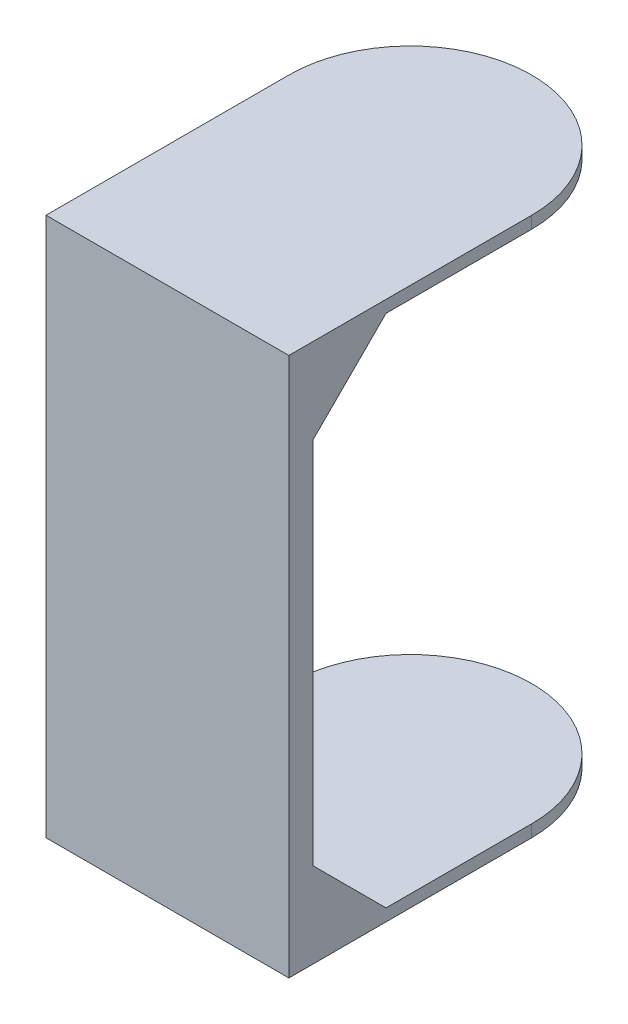
from build123d import *

# Parameters (mm, degrees)
PLATE_SKETCH_W                  = 100
PLATE_SKETCH_H                  = 212
PLATE_EXTRUDE_DEPTH             = 10
PRIMARY_SUPPORT_EXTRUDE_DEPTH   = 10
SECONDARY_SUPPORT_EXTRUDE_DEPTH = 10
GRIPPER_EXTRUDE_DEPTH           = 5


with BuildPart() as part:
    # Plate Sketch → Plate Extrude (new body)
    with BuildSketch(Plane.XY):
        Rectangle(PLATE_SKETCH_W, PLATE_SKETCH_H)
    extrude(amount=-PLATE_EXTRUDE_DEPTH)

    # Primary Support Sketch → Primary Support Extrude (add)
    with BuildSketch(Plane(origin=(50, 0, 0), x_dir=(0, 0, -1), z_dir=(1, 0, 0))):
        Polygon((10, 106), (10, 76), (40, 106), align=None)
    primary_support_extrude = extrude(amount=-PRIMARY_SUPPORT_EXTRUDE_DEPTH)

    # Primary Support Mirror: Primary Support Extrude across plane
    add(primary_support_extrude.mirror(Plane.ZX))

    # Secondary Support Sketch → Secondary Support Extrude (add)
    with BuildSketch(Plane.ZY.offset(50)):
        Polygon((-10, -76), (-40, -106), (-10, -106), align=None)
    extrude(amount=-SECONDARY_SUPPORT_EXTRUDE_DEPTH)

    # Gripper Sketch → Gripper Extrude (add)
    with BuildSketch(Plane(origin=(0, 106, 0), x_dir=(1, 0, 0), z_dir=(0, 1, 0))):
        with BuildLine():
            Line((-50, 0), (50, 0))
            Line((50, 0), (50, 100))
            ThreePointArc((50, 100), (0, 150), (-50, 100))
            Line((-50, 100), (-50, 0))
        make_face()
    gripper_extrude = extrude(amount=GRIPPER_EXTRUDE_DEPTH)

    # Gripper Mirror: Gripper Extrude across plane
    add(gripper_extrude.mirror(Plane.ZX))


solid = part.part
